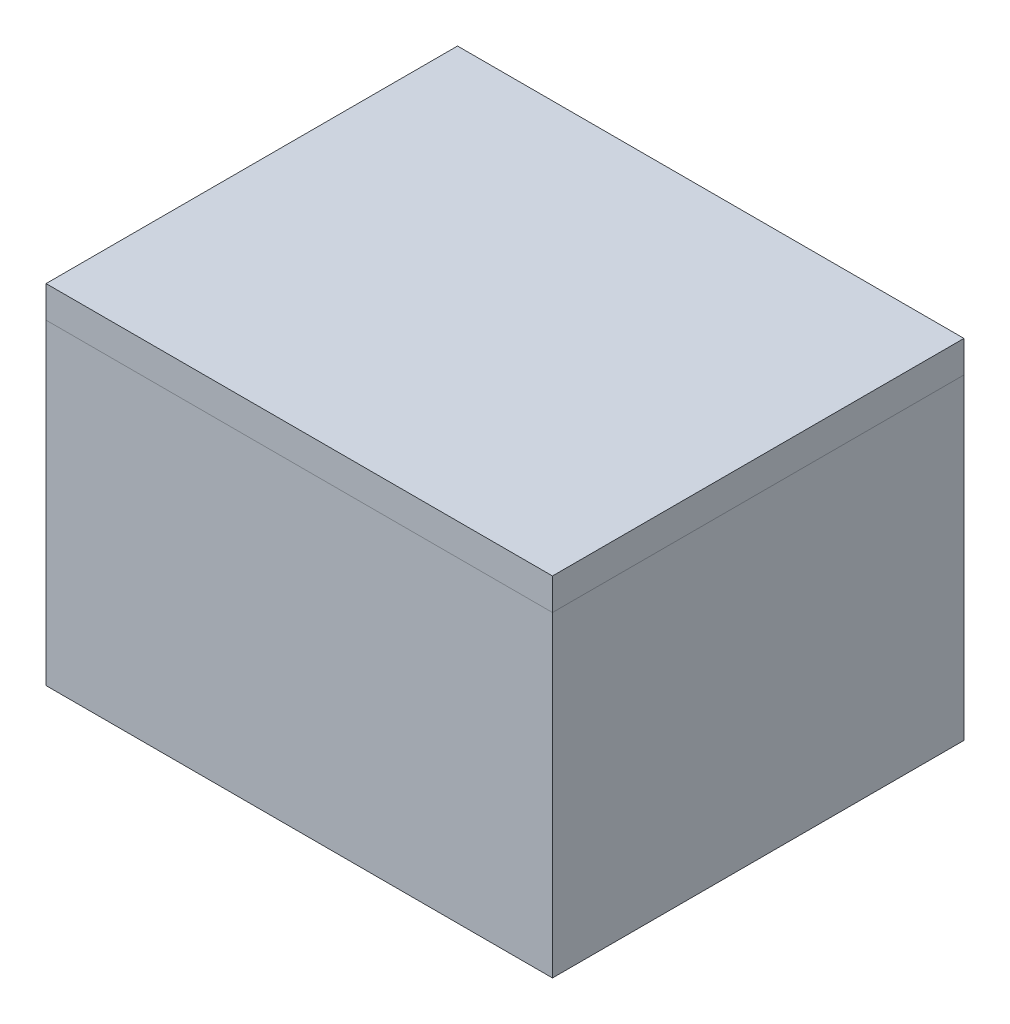
from build123d import *

# Parameters (mm, degrees)
SKETCH1_W           = 203.2
SKETCH1_H           = 165.1
BOSS_EXTRUDE1_DEPTH = 12.7
SKETCH2_W           = 203.2
SKETCH2_H           = 165.1
SKETCH2_W_2         = 177.8
SKETCH2_H_2         = 139.7
BOSS_EXTRUDE2_DEPTH = 127


with BuildPart() as part:
    # Sketch1 → Boss-Extrude1 (new body)
    with BuildSketch(Plane(origin=(0, 0, 0), x_dir=(1, 0, 0), z_dir=(0, 1, 0))):
        Rectangle(SKETCH1_W, SKETCH1_H)
    extrude(amount=BOSS_EXTRUDE1_DEPTH)


with BuildPart() as body_2:
    # Sketch2 → Boss-Extrude2 (new body)
    with BuildSketch(Plane.XZ):
        Rectangle(SKETCH2_W, SKETCH2_H)
        Rectangle(SKETCH2_W_2, SKETCH2_H_2, mode=Mode.SUBTRACT)
    extrude(amount=BOSS_EXTRUDE2_DEPTH)


solid = Compound([part.part, body_2.part])
